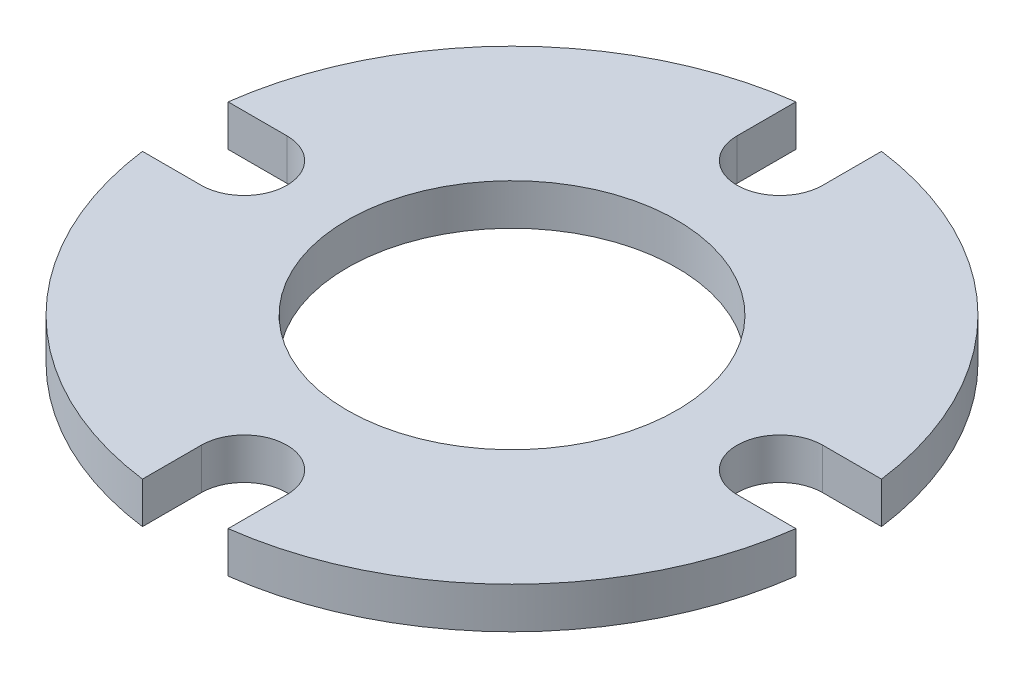
from build123d import *

# Parameters (mm, degrees)
SKETCH1_R           = 0.5
BOSS_EXTRUDE1_DEPTH = 0.125


with BuildPart() as part:
    # Sketch1 → Boss-Extrude1 (new body)
    with BuildSketch(Plane(origin=(0, 0, 0), x_dir=(1, 0, 0), z_dir=(0, 1, 0))):
        with BuildLine():
            Line((0.813, 0.13), (0.991513994, 0.13))
            ThreePointArc((0.991513994, 0.13), (0.707106781, 0.707106781), (0.13, 0.991513994))
            Line((0.13, 0.991513994), (0.13, 0.813))
            ThreePointArc((0.13, 0.813), (0, 0.683), (-0.13, 0.813))
            Line((-0.13, 0.813), (-0.13, 0.991513994))
            ThreePointArc((-0.13, 0.991513994), (-0.707106781, 0.707106781), (-0.991513994, 0.13))
            Line((-0.991513994, 0.13), (-0.813, 0.13))
            ThreePointArc((-0.813, 0.13), (-0.683, 0), (-0.813, -0.13))
            Line((-0.813, -0.13), (-0.991513994, -0.13))
            ThreePointArc((-0.991513994, -0.13), (-0.707106781, -0.707106781), (-0.13, -0.991513994))
            Line((-0.13, -0.991513994), (-0.13, -0.813))
            ThreePointArc((-0.13, -0.813), (0, -0.683), (0.13, -0.813))
            Line((0.13, -0.813), (0.13, -0.991513994))
            ThreePointArc((0.13, -0.991513994), (0.707106781, -0.707106781), (0.991513994, -0.13))
            Line((0.991513994, -0.13), (0.813, -0.13))
            ThreePointArc((0.813, -0.13), (0.683, 0), (0.813, 0.13))
        make_face()
        with Locations(Location((0, 0, 0), (0, 0, 270))):
            Circle(SKETCH1_R, mode=Mode.SUBTRACT)
    extrude(amount=BOSS_EXTRUDE1_DEPTH)


solid = part.part
